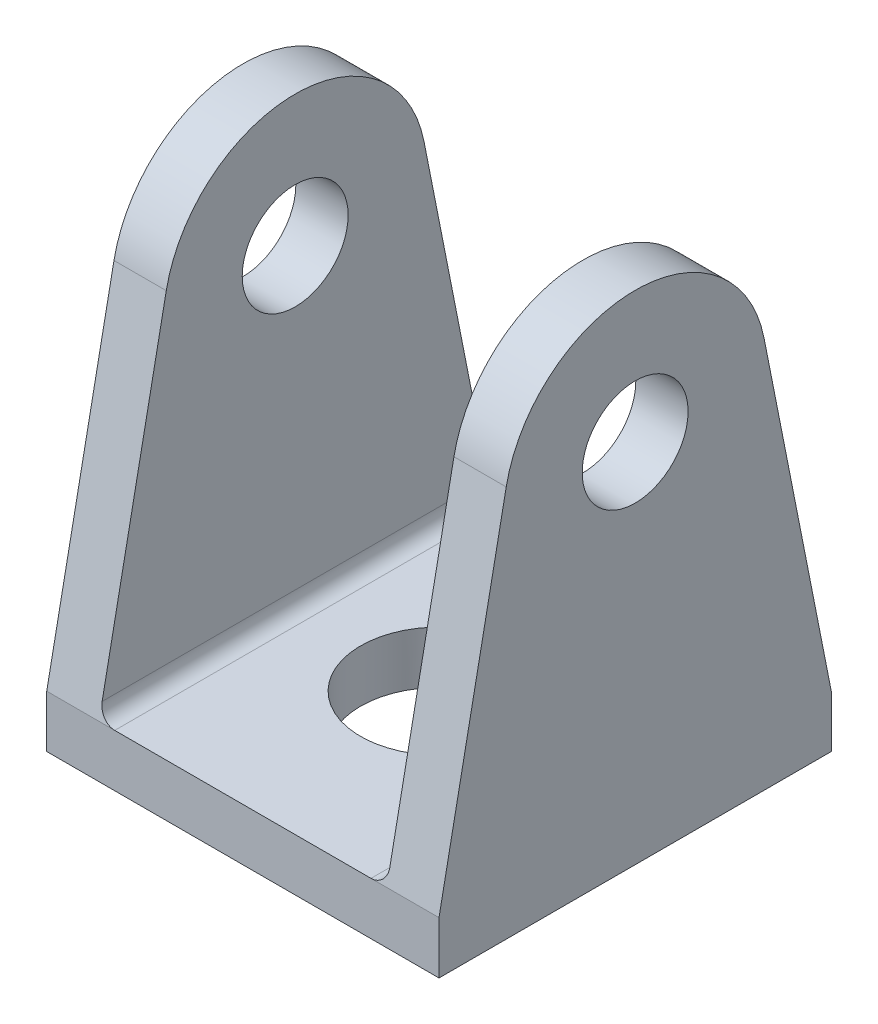
from build123d import *

# Parameters (mm, degrees)
ESQUISSE1_W             = 75
ESQUISSE1_H             = 75
ESQUISSE1_R             = 15
BOSS_EXTRU_2_DEPTH      = 10
ESQUISSE2_R             = 10.125
BOSS_EXTRU_3_DEPTH      = 75
ESQUISSE3_W             = 55
ESQUISSE3_H             = 122.401822982
ENL_V_MAT_EXTRU_1_DEPTH = 143.473736615
CONG_1_R                = 3


with BuildPart() as part:
    # Esquisse1 → Boss.-Extru.2 (new body)
    with BuildSketch(Plane(origin=(0, 0, 0), x_dir=(1, 0, 0), z_dir=(0, 1, 0))):
        with Locations((37.5, 37.5)):
            Rectangle(ESQUISSE1_W, ESQUISSE1_H)
        with Locations(Location((37.5, 37.5, 0), (0, 0, 270))):
            Circle(ESQUISSE1_R, mode=Mode.SUBTRACT)
    extrude(amount=BOSS_EXTRU_2_DEPTH)

    # Esquisse2 → Boss.-Extru.3 (add)
    with BuildSketch(Plane(origin=(75, 0, 0), x_dir=(0, 0, -1), z_dir=(1, 0, 0))):
        with BuildLine():
            Line((62.145999584, 74.88265599), (75, 10))
            Line((75, 10), (0, 10))
            Line((0, 10), (12.854000416, 74.88265599))
            ThreePointArc((12.854000416, 74.88265599), (37.5, 95.125), (62.145999584, 74.88265599))
        make_face()
        with Locations((37.5, 70)):
            Circle(ESQUISSE2_R, mode=Mode.SUBTRACT)
    extrude(amount=-BOSS_EXTRU_3_DEPTH)

    # Esquisse3 → Enlèv. mat.-Extru.1 (cut, through all)
    with BuildSketch(Plane.XY):
        with Locations((37.5, 71.200911491)):
            Rectangle(ESQUISSE3_W, ESQUISSE3_H)
    extrude(amount=-ENL_V_MAT_EXTRU_1_DEPTH, mode=Mode.SUBTRACT)

    # Congé1
    cong_1_edges = [part.edges().sort_by_distance(p)[0] for p in [
        (10, 10, -37.5),
        (65, 10, -37.5),
    ]]
    fillet(cong_1_edges, radius=CONG_1_R)


solid = part.part
